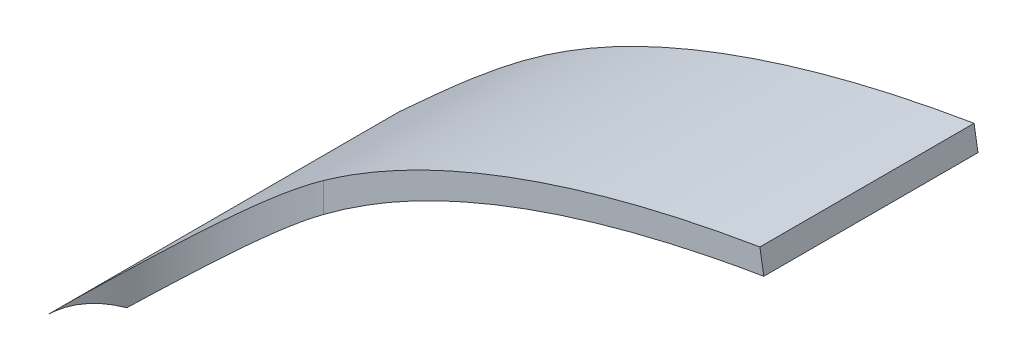
from build123d import *

# Parameters (mm, degrees)
EXTRUDE_1_DEPTH     = 10
CUT_EXTRUDE_1_DEPTH = 31


with BuildPart() as part:
    # 草图1 → 凸台-拉伸1 (new body)
    with BuildSketch(Plane.XY):
        with BuildLine():
            Line((0.099286908, 16.408271929), (0, 17))
            add(Edge.make_bspline(
                [(-14.5, 10), (-13.275700684, 11.118325177), (-10.667201811, 13.52025873), (-5.620487725, 15.809154008), (-1.923873666, 16.677190458), (0, 17)],
                knots=[0, 0, 0, 0, 0.304837744, 0.643087388, 1, 1, 1, 1], degree=3))
            Line((-14.5, 10), (-14.095342354, 9.5569964))
            add(Edge.make_bspline(
                [(-14.095342354, 9.5569964), (-13.101804871, 10.464534261), (-11.5913204, 11.856193918), (-9.408207232, 13.308108948), (-7.031706102, 14.512216909), (-3.856829789, 15.620046614), (-1.224798532, 16.18610172), (0.099286908, 16.408271929)],
                knots=[0, 0, 0, 0, 0.25, 0.375, 0.5, 0.75, 1, 1, 1, 1], degree=3))
        make_face()
    extrude(amount=EXTRUDE_1_DEPTH)

    # 草图2 → 切除-拉伸1 (cut)
    with BuildSketch(Plane(origin=(0, 0, 0), x_dir=(1, 0, 0), z_dir=(0, 1, 0))):
        with BuildLine():
            Line((2.542403036, -5.4), (-11, -5.4))
            ThreePointArc((-11, -5.4), (-13.474873734, -6.425126266), (-14.5, -8.9))
            Line((-14.5, -8.9), (-14.5, -10))
            Line((-14.5, -10), (-14.5, -12.270940409))
            Line((-14.5, -12.270940409), (2.542403036, -12.270940409))
            Line((2.542403036, -12.270940409), (2.542403036, -5.4))
        make_face()
    extrude(amount=CUT_EXTRUDE_1_DEPTH, mode=Mode.SUBTRACT)


solid = part.part
